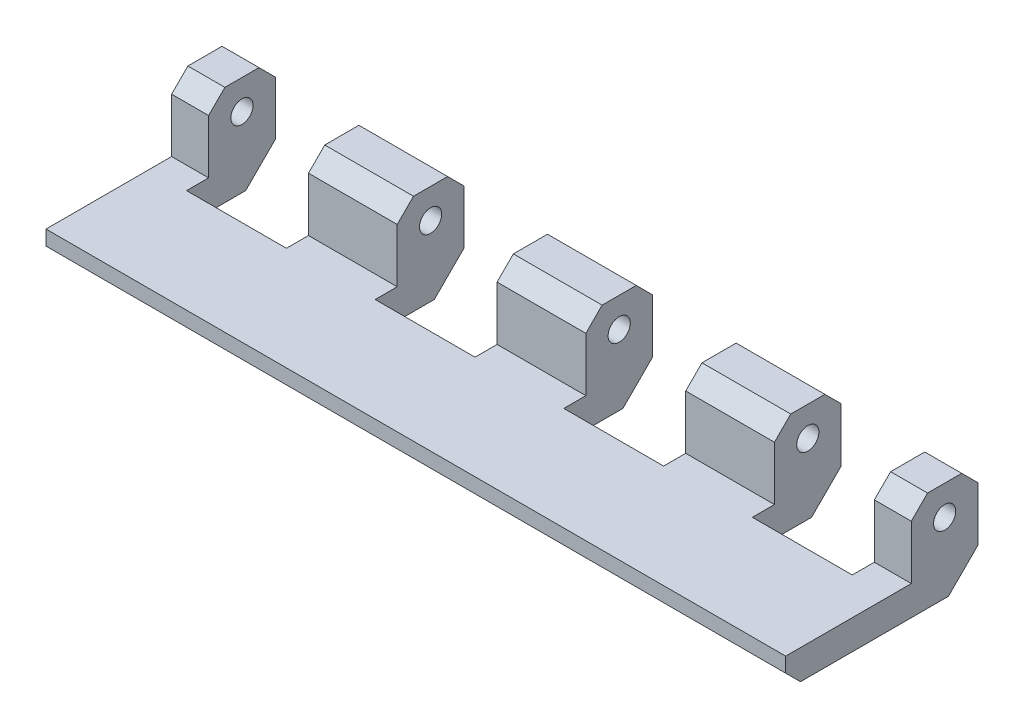
from build123d import *

# Parameters (mm, degrees)
SKETCH_1_W          = 100
SKETCH_1_H          = 26
EXTRUDE_1_DEPTH     = 13.5
SKETCH_2_W          = 19.106704299
SKETCH_2_H          = 9.5
CUT_EXTRUDE_1_DEPTH = 105.202927022
CHAMFER_1_SIZE      = 2.2
CHAMFER_2_SIZE      = 4
SKETCH_3_R          = 1.5
CUT_EXTRUDE_2_DEPTH = 105.202927022
SKETCH_4_W          = 13.5
SKETCH_4_H          = 12
CUT_EXTRUDE_3_DEPTH = 82.450905458
CHAMFER_3_SIZE      = 2


with BuildPart() as part:
    # Эскиз1 → Вытянуть1 (new body)
    with BuildSketch(Plane(origin=(0, 0, 0), x_dir=(1, 0, 0), z_dir=(0, 1, 0))):
        with Locations((26, -13)):
            Rectangle(SKETCH_1_W, SKETCH_1_H)
    extrude(amount=EXTRUDE_1_DEPTH)

    # Эскиз2 → Вырез-Вытянуть1 (cut, through all)
    with BuildSketch(Plane(origin=(76, 0, 0), x_dir=(0, 0, -1), z_dir=(1, 0, 0))):
        with Locations((-18.569613205, 8.75)):
            Rectangle(SKETCH_2_W, SKETCH_2_H)
    extrude(amount=-CUT_EXTRUDE_1_DEPTH, mode=Mode.SUBTRACT)

    # Фаска1
    chamfer_1_edges = [part.edges().sort_by_distance(p)[0] for p in [
        (26, 13.5, 0),
        (26, 13.5, 9.016261055),
    ]]
    chamfer(chamfer_1_edges, length=CHAMFER_1_SIZE)

    # Фаска2
    chamfer_2_edges = [part.edges().sort_by_distance(p)[0] for p in [
        (26, 0, 0),
    ]]
    chamfer(chamfer_2_edges, length=CHAMFER_2_SIZE)

    # Эскиз3 → Вырез-Вытянуть2 (cut, through all)
    with BuildSketch(Plane(origin=(76, 0, 0), x_dir=(0, 0, -1), z_dir=(1, 0, 0))):
        with Locations((-4.508130527, 9.5)):
            Circle(SKETCH_3_R)
    extrude(amount=-CUT_EXTRUDE_2_DEPTH, mode=Mode.SUBTRACT)

    # Эскиз4 → Вырез-Вытянуть3 (cut, through all)
    with BuildSketch(Plane(origin=(0, 13.5, 0), x_dir=(1, 0, 0), z_dir=(0, 1, 0))):
        with Locations((-12.25, -6)):
            Rectangle(SKETCH_4_W, SKETCH_4_H)
        with Locations((64.25, -6)):
            Rectangle(SKETCH_4_W, SKETCH_4_H)
        with Locations((13.25, -6)):
            Rectangle(SKETCH_4_W, SKETCH_4_H)
        with Locations((38.75, -6)):
            Rectangle(SKETCH_4_W, SKETCH_4_H)
    extrude(amount=-CUT_EXTRUDE_3_DEPTH, mode=Mode.SUBTRACT)

    # Фаска3
    chamfer_3_edges = [part.edges().sort_by_distance(p)[0] for p in [
        (26, 0, 26),
    ]]
    chamfer(chamfer_3_edges, length=CHAMFER_3_SIZE)


solid = part.part
